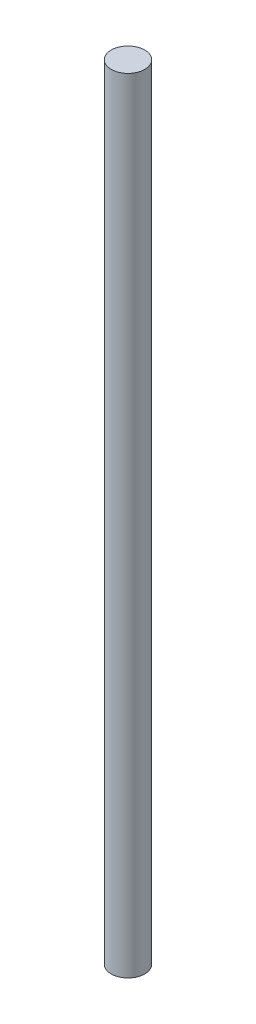
from build123d import *

# Parameters (mm, degrees)
SKETCH1_R           = 3
BOSS_EXTRUDE1_DEPTH = 140


with BuildPart() as part:
    # Sketch1 → Boss-Extrude1 (new body)
    with BuildSketch(Plane(origin=(0, 0, 0), x_dir=(1, 0, 0), z_dir=(0, 1, 0))):
        with Locations(Location((0, 0, 0), (0, 0, 270))):
            Circle(SKETCH1_R)
    extrude(amount=BOSS_EXTRUDE1_DEPTH)


solid = part.part
